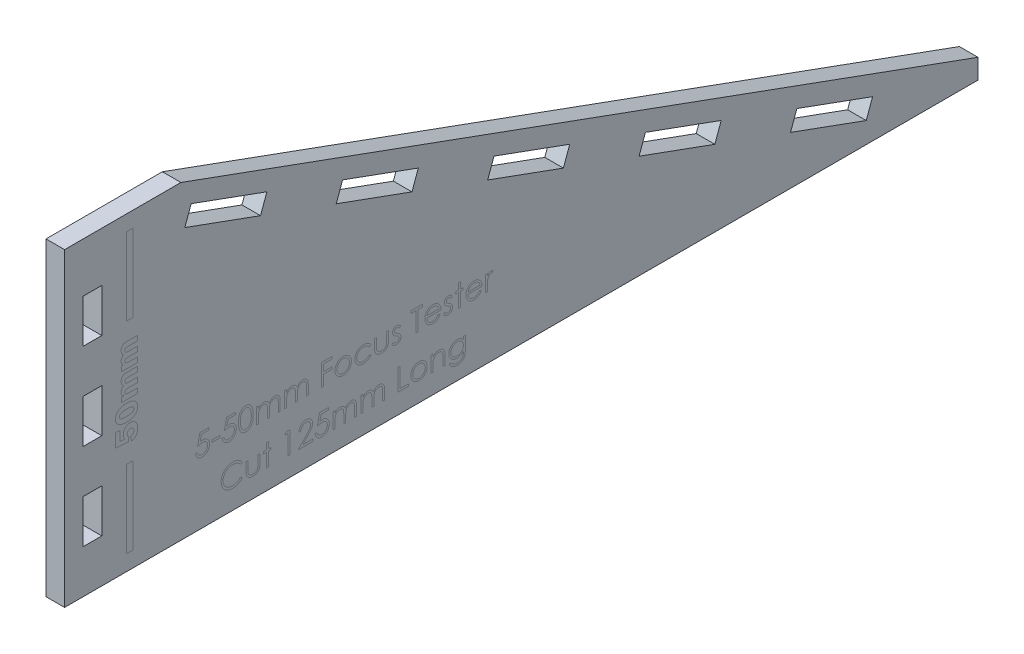
from build123d import *

# Parameters (mm, degrees)
SKETCH1_W           = 3
SKETCH1_H           = 7
BOSS_EXTRUDE1_DEPTH = 3


with BuildPart() as part:
    # Sketch1 → Boss-Extrude1 (new body)
    with BuildSketch(Plane(origin=(0, 0, 0), x_dir=(0, 0, -1), z_dir=(1, 0, 0))):
        Polygon((0, 50), (-10, 50), (-10, 0), (137.373870973, 0), (137.373870973, 3.192533317), (8.7714132, 50), align=None)
        Polygon((10.422986638, 46.206343112), (9.396926208, 43.387265249), (21.612930278, 38.941003386), (22.638990708, 41.760081248), align=None, mode=Mode.SUBTRACT)
        Polygon((34.854994778, 37.313819385), (33.828934348, 34.494741523), (46.044938419, 30.04847966), (47.070998848, 32.867557522), align=None, mode=Mode.SUBTRACT)
        Polygon((119.34096284, 3.37090848), (120.36702327, 6.189986343), (108.1510192, 10.636248206), (107.12495877, 7.817170343), align=None, mode=Mode.SUBTRACT)
        Polygon((95.935015129, 15.082510069), (94.908954699, 12.263432207), (82.692950629, 16.70969407), (83.719011059, 19.528771932), align=None, mode=Mode.SUBTRACT)
        Polygon((59.287002919, 28.421295659), (58.260942489, 25.602217796), (70.476946559, 21.155955933), (71.503006989, 23.975033796), align=None, mode=Mode.SUBTRACT)
        with Locations((-5.5, 38.5)):
            Rectangle(SKETCH1_W, SKETCH1_H, mode=Mode.SUBTRACT)
        with Locations((-5.5, 24.5)):
            Rectangle(SKETCH1_W, SKETCH1_H, mode=Mode.SUBTRACT)
        with Locations((-5.5, 10.5)):
            Rectangle(SKETCH1_W, SKETCH1_H, mode=Mode.SUBTRACT)
    extrude(amount=BOSS_EXTRUDE1_DEPTH)


solid = part.part
